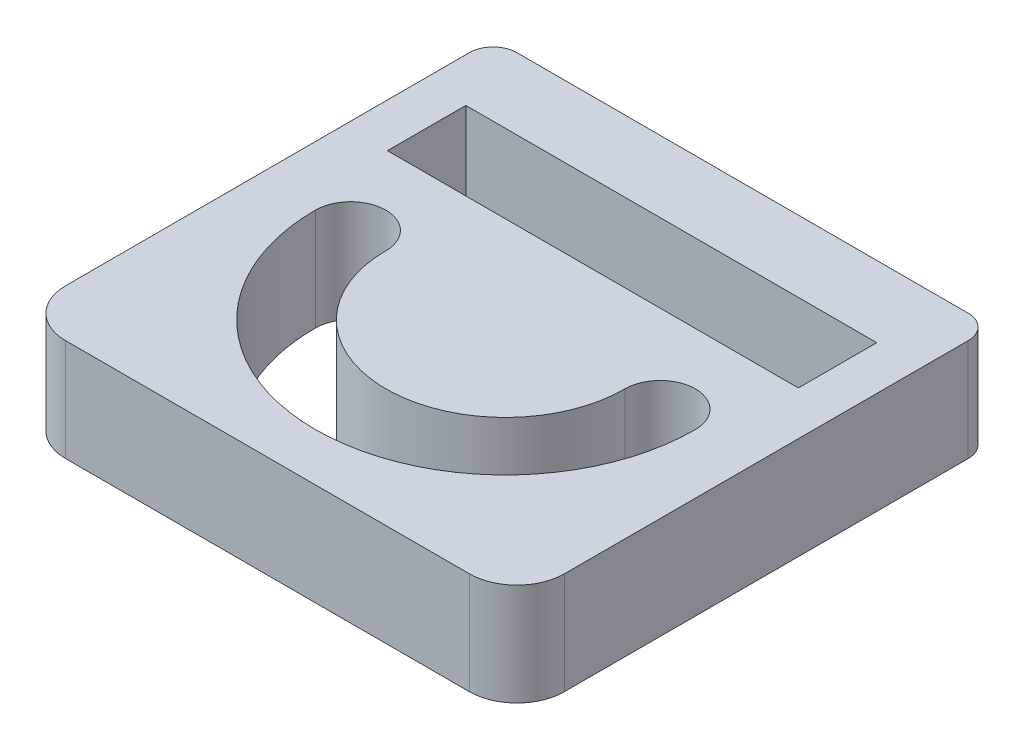
from build123d import *

# Parameters (mm, degrees)
ESBO_O2_W                = 21
ESBO_O2_H                = 20
ESBO_O2_W_2              = 17.3
ESBO_O2_H_2              = 3.3
RESSALTO_EXTRUS_O1_DEPTH = 4.3
FILETE1_R                = 1
FILETE2_R                = 1
FILETE3_R                = 2
FILETE4_R                = 2
CORTE_EXTRUS_O3_DEPTH    = 4.3


with BuildPart() as part:
    # Esboço2 → Ressalto-extrusão1 (new body)
    with BuildSketch(Plane(origin=(0, 0, 0), x_dir=(1, 0, 0), z_dir=(0, 1, 0))):
        Rectangle(ESBO_O2_W, ESBO_O2_H)
        with Locations((0, 5.35)):
            Rectangle(ESBO_O2_W_2, ESBO_O2_H_2, mode=Mode.SUBTRACT)
    extrude(amount=RESSALTO_EXTRUS_O1_DEPTH)

    # Filete1
    filete1_edges = [part.edges().sort_by_distance(p)[0] for p in [
        (10.5, 2.15, -10),
    ]]
    fillet(filete1_edges, radius=FILETE1_R)

    # Filete2
    filete2_edges = [part.edges().sort_by_distance(p)[0] for p in [
        (-10.5, 2.15, -10),
    ]]
    fillet(filete2_edges, radius=FILETE2_R)

    # Filete3
    filete3_edges = [part.edges().sort_by_distance(p)[0] for p in [
        (-10.5, 2.15, 10),
    ]]
    fillet(filete3_edges, radius=FILETE3_R)

    # Filete4
    filete4_edges = [part.edges().sort_by_distance(p)[0] for p in [
        (10.5, 2.15, 10),
    ]]
    fillet(filete4_edges, radius=FILETE4_R)

    # Esboço6 → Corte-extrusão3 (cut)
    with BuildSketch(Plane(origin=(0, 4.3, 0), x_dir=(1, 0, 0), z_dir=(0, 1, 0))):
        with BuildLine():
            ThreePointArc((-8, 0.016269222), (0, -7.983730778), (8, 0.016269222))
            ThreePointArc((8, 0.016269222), (6.516269222, 1.5), (5.032538443, 0.016269222))
            ThreePointArc((5.032538443, 0.016269222), (0, -5.016269222), (-5.032538443, 0.016269222))
            ThreePointArc((-5.032538443, 0.016269222), (-6.516269222, 1.5), (-8, 0.016269222))
        make_face()
    extrude(amount=-CORTE_EXTRUS_O3_DEPTH, mode=Mode.SUBTRACT)


solid = part.part
